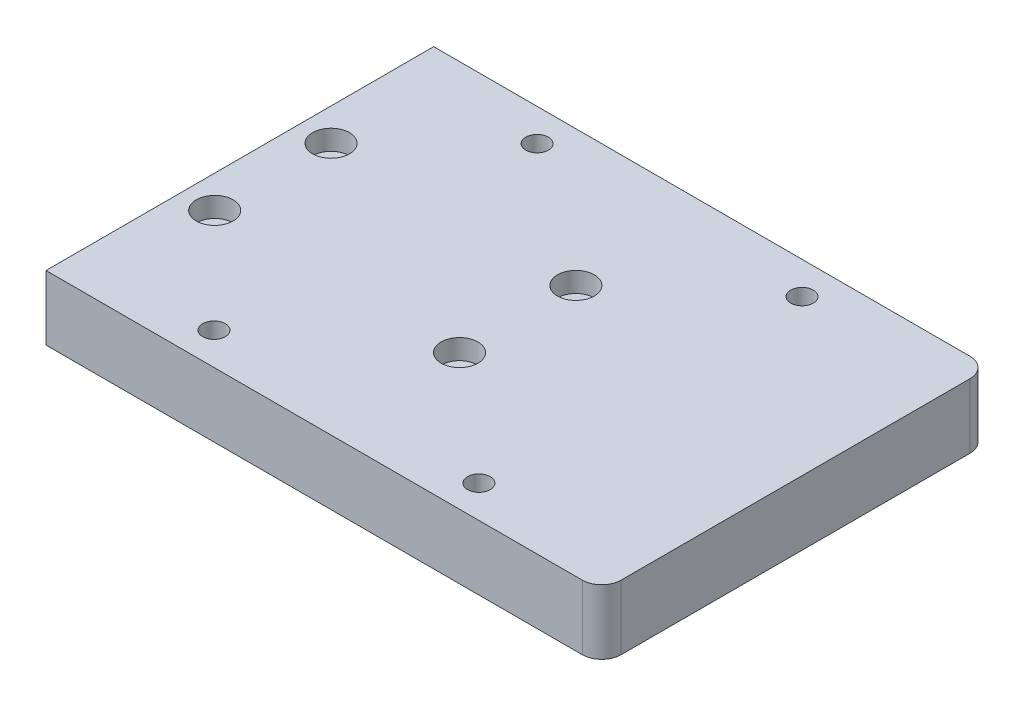
from build123d import *

# Parameters (mm, degrees)
SKETCH_1_W          = 86
SKETCH_1_H          = 60
EXTRUDE_1_DEPTH     = 10
FILLET_1_R          = 3
SKETCH_2_R          = 1.25
CUT_EXTRUDE_1_DEPTH = 54.37602458
SKETCH_3_R          = 2.85
CUT_EXTRUDE_2_DEPTH = 3.1
SKETCH_4_R          = 1.75
CUT_EXTRUDE_3_DEPTH = 54.37602458


with BuildPart() as part:
    # 草图1 → 凸台-拉伸1 (new body)
    with BuildSketch(Plane(origin=(0, 0, 0), x_dir=(1, 0, 0), z_dir=(0, 1, 0))):
        Rectangle(SKETCH_1_W, SKETCH_1_H)
    extrude(amount=EXTRUDE_1_DEPTH)

    # 圆角1
    fillet_1_edges = [part.edges().sort_by_distance(p)[0] for p in [
        (43, 5, 30),
        (43, 5, -30),
    ]]
    fillet(fillet_1_edges, radius=FILLET_1_R)

    # 草图2 → 切除-拉伸1 (cut, through all)
    with BuildSketch(Plane(origin=(0, 10, 0), x_dir=(1, 0, 0), z_dir=(0, 1, 0))):
        with Locations(Location((-38, -8.88983487, 0), (0, 0, 270))):
            Circle(SKETCH_2_R)
        with Locations(Location((-38, 9.11016513, 0), (0, 0, 270))):
            Circle(SKETCH_2_R)
        with Locations(Location((0, 9, 0), (0, 0, 270))):
            Circle(SKETCH_2_R)
        with Locations(Location((0, -9, 0), (0, 0, 270))):
            Circle(SKETCH_2_R)
    extrude(amount=-CUT_EXTRUDE_1_DEPTH, mode=Mode.SUBTRACT)

    # 草图3 → 切除-拉伸2 (cut)
    with BuildSketch(Plane(origin=(0, 10, 0), x_dir=(1, 0, 0), z_dir=(0, 1, 0))):
        with Locations(Location((-38, -8.88983487, 0), (0, 0, 270))):
            Circle(SKETCH_3_R)
        with Locations(Location((-38, 9.11016513, 0), (0, 0, 270))):
            Circle(SKETCH_3_R)
        with Locations(Location((0, -9, 0), (0, 0, 270))):
            Circle(SKETCH_3_R)
        with Locations(Location((0, 9, 0), (0, 0, 270))):
            Circle(SKETCH_3_R)
    extrude(amount=-CUT_EXTRUDE_2_DEPTH, mode=Mode.SUBTRACT)

    # 草图4 → 切除-拉伸3 (cut, through all)
    with BuildSketch(Plane(origin=(0, 10, 0), x_dir=(1, 0, 0), z_dir=(0, 1, 0))):
        with Locations(Location((-22, -25, 0), (0, 0, 270))):
            Circle(SKETCH_4_R)
        with Locations(Location((-22, 25, 0), (0, 0, 270))):
            Circle(SKETCH_4_R)
        with Locations(Location((19, -25, 0), (0, 0, 270))):
            Circle(SKETCH_4_R)
        with Locations(Location((19, 25, 0), (0, 0, 270))):
            Circle(SKETCH_4_R)
    extrude(amount=-CUT_EXTRUDE_3_DEPTH, mode=Mode.SUBTRACT)


solid = part.part
